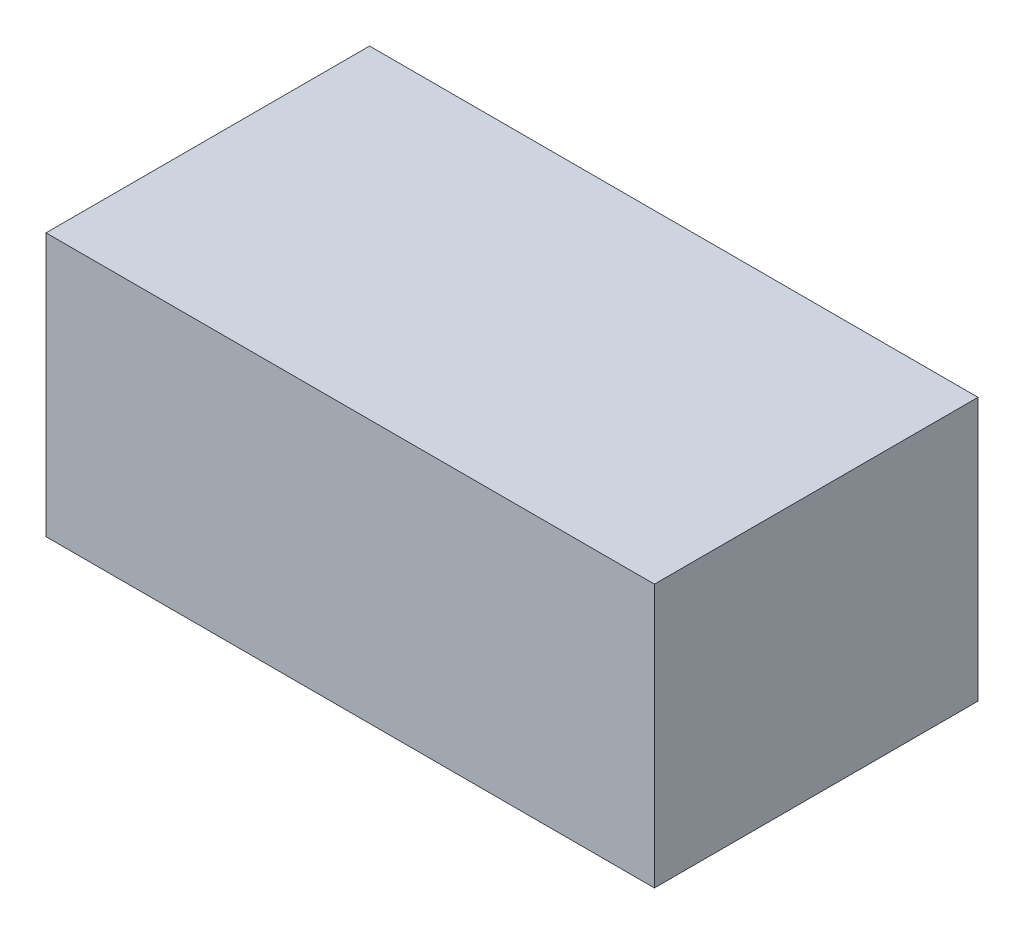
from build123d import *

# Parameters (mm, degrees)
SKETCH1_W           = 71.642199208
SKETCH1_H           = 70.342787867
BOSS_EXTRUDE1_DEPTH = 38.1


with BuildPart() as part:
    # Sketch1 → Boss-Extrude1 (new body)
    with BuildSketch(Plane.XY):
        with Locations((-35.821099604, 4.186792888)):
            Rectangle(SKETCH1_W, SKETCH1_H)
    extrude(amount=BOSS_EXTRUDE1_DEPTH)

    # SurfaceCut1
    split(bisect_by=Plane(origin=(0, 0, 0), x_dir=(1, 0, 0), z_dir=(0, 1, 0)), keep=Keep.BOTTOM)


solid = part.part
